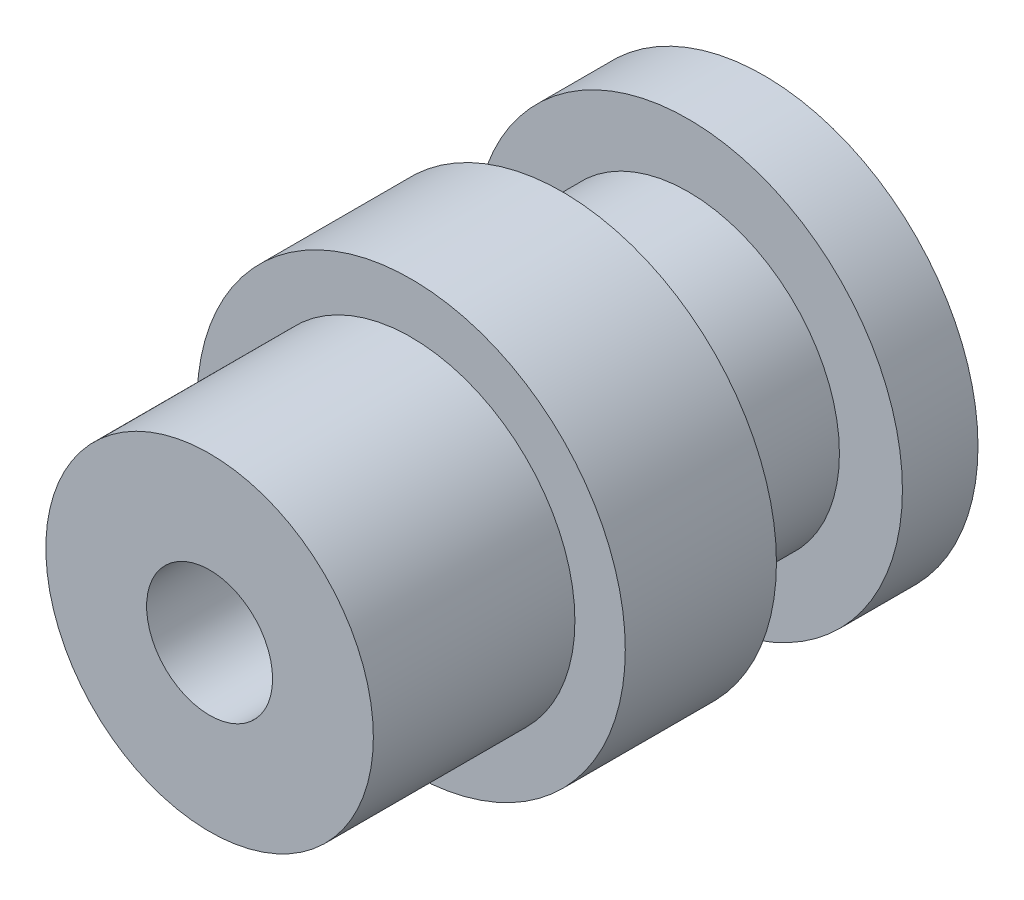
from build123d import *

# Parameters (mm, degrees)
THREAD_START          = -5
SKETCH1_R             = 6
THREAD_DEPTH          = 5
LOCK_NUT_START        = -8
SKETCH2_R             = 8.5
LOCK_NUT_DEPTH        = 3
SKETCH3_R             = 8.5
BODY_DEPTH            = 6
DOME_START            = 6
SKETCH4_R             = 6.5
DOME_DEPTH            = 8
CABLE_HOLE_DEPTH      = 19.452642087
CABLE_HOLE_DEPTH_BACK = 19.452642087
SKETCH5_R             = 2.5


with BuildPart() as part:
    # Sketch1 → Thread (new body)
    with BuildSketch(Plane.XY.offset(THREAD_START)):
        Circle(SKETCH1_R)
    extrude(amount=THREAD_DEPTH)

    # Sketch2 → Lock_Nut (add)
    with BuildSketch(Plane.XY.offset(LOCK_NUT_START)):
        Circle(SKETCH2_R)
    extrude(amount=LOCK_NUT_DEPTH)

    # Sketch3 → Body (add)
    with BuildSketch(Plane.XY):
        Circle(SKETCH3_R)
    extrude(amount=BODY_DEPTH)

    # Sketch4 → Dome (add)
    with BuildSketch(Plane.XY.offset(DOME_START)):
        Circle(SKETCH4_R)
    extrude(amount=DOME_DEPTH)

    # Sketch5 → Cable_Hole (cut, two sides: drawn at the far end of the back side and taken through both)
    with BuildSketch(Plane.XY.offset(-CABLE_HOLE_DEPTH_BACK)):
        Circle(SKETCH5_R)
    extrude(amount=CABLE_HOLE_DEPTH + CABLE_HOLE_DEPTH_BACK, mode=Mode.SUBTRACT)


solid = part.part
